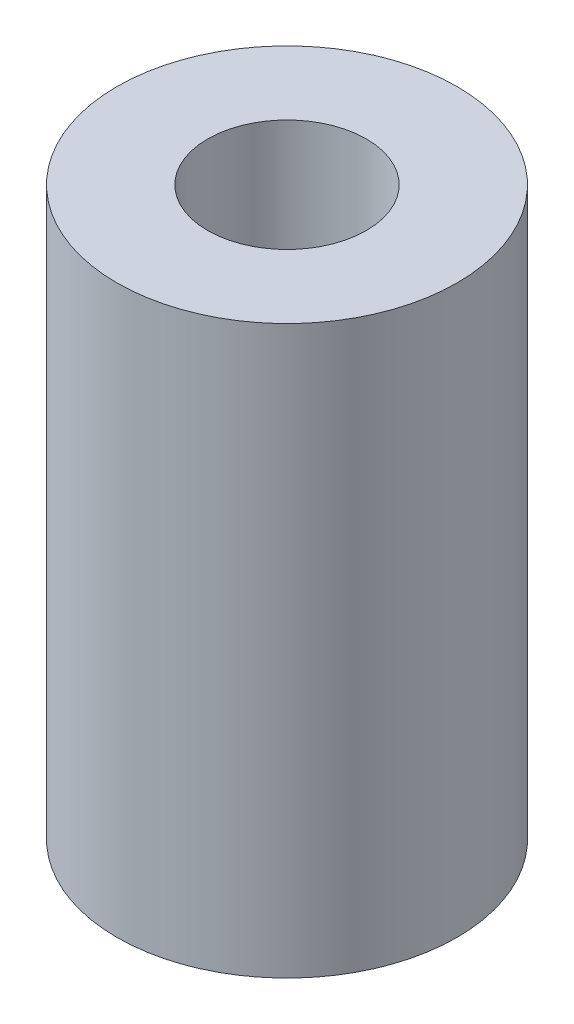
from build123d import *

# Parameters (mm, degrees)
ESQUISSE1_R        = 3
ESQUISSE1_R_2      = 1.4
BOSS_EXTRU_1_DEPTH = 10


with BuildPart() as part:
    # Esquisse1 → Boss.-Extru.1 (new body)
    with BuildSketch(Plane(origin=(0, 0, 0), x_dir=(1, 0, 0), z_dir=(0, 1, 0))):
        with Locations(Location((0, 0, 0), (0, 0, 270))):
            Circle(ESQUISSE1_R)
        with Locations(Location((0, 0, 0), (0, 0, 270))):
            Circle(ESQUISSE1_R_2, mode=Mode.SUBTRACT)
    extrude(amount=BOSS_EXTRU_1_DEPTH)


solid = part.part
